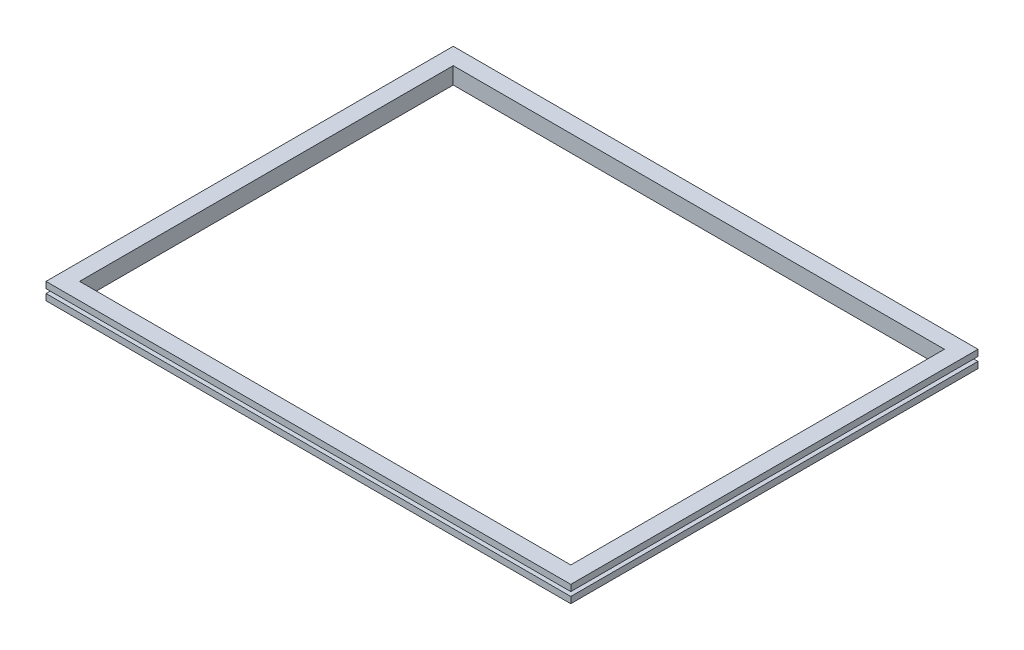
from build123d import *

# Parameters (mm, degrees)
SKETCH1_W               = 1250
SKETCH1_H               = 970
SKETCH1_W_2             = 1170
SKETCH1_H_2             = 890
BOSS_EXTRUDE1_DEPTH     = 40
CUT_EXTRUDE1_DEPTH      = 1155.610323876
CUT_EXTRUDE1_DEPTH_BACK = 1155.610323876
SKETCH2_W               = 10
SKETCH2_H               = 10
CUT_EXTRUDE2_DEPTH      = 1342.389205264
CUT_EXTRUDE2_DEPTH_BACK = 1342.389205264
SKETCH3_W               = 10
SKETCH3_H               = 10


with BuildPart() as part:
    # Sketch1 → Boss-Extrude1 (new body)
    with BuildSketch(Plane(origin=(0, 0, 0), x_dir=(1, 0, 0), z_dir=(0, 1, 0))):
        Rectangle(SKETCH1_W, SKETCH1_H)
        Rectangle(SKETCH1_W_2, SKETCH1_H_2, mode=Mode.SUBTRACT)
    extrude(amount=BOSS_EXTRUDE1_DEPTH)

    # Sketch2 → Cut-Extrude1 (cut, two sides: drawn at the far end of the back side and taken through both)
    with BuildSketch(Plane.XY.offset(485).offset(-CUT_EXTRUDE1_DEPTH_BACK)):
        with Locations((-620, 20)):
            Rectangle(SKETCH2_W, SKETCH2_H)
        with Locations((620, 20)):
            Rectangle(SKETCH2_W, SKETCH2_H)
    extrude(amount=CUT_EXTRUDE1_DEPTH + CUT_EXTRUDE1_DEPTH_BACK, mode=Mode.SUBTRACT)

    # Sketch3 → Cut-Extrude2 (cut, two sides: drawn at the far end of the back side and taken through both)
    with BuildSketch(Plane.ZY.offset(625).offset(-CUT_EXTRUDE2_DEPTH_BACK)):
        with Locations((480, 20)):
            Rectangle(SKETCH3_W, SKETCH3_H)
        with Locations((-480, 20)):
            Rectangle(SKETCH3_W, SKETCH3_H)
    extrude(amount=CUT_EXTRUDE2_DEPTH + CUT_EXTRUDE2_DEPTH_BACK, mode=Mode.SUBTRACT)


solid = part.part
